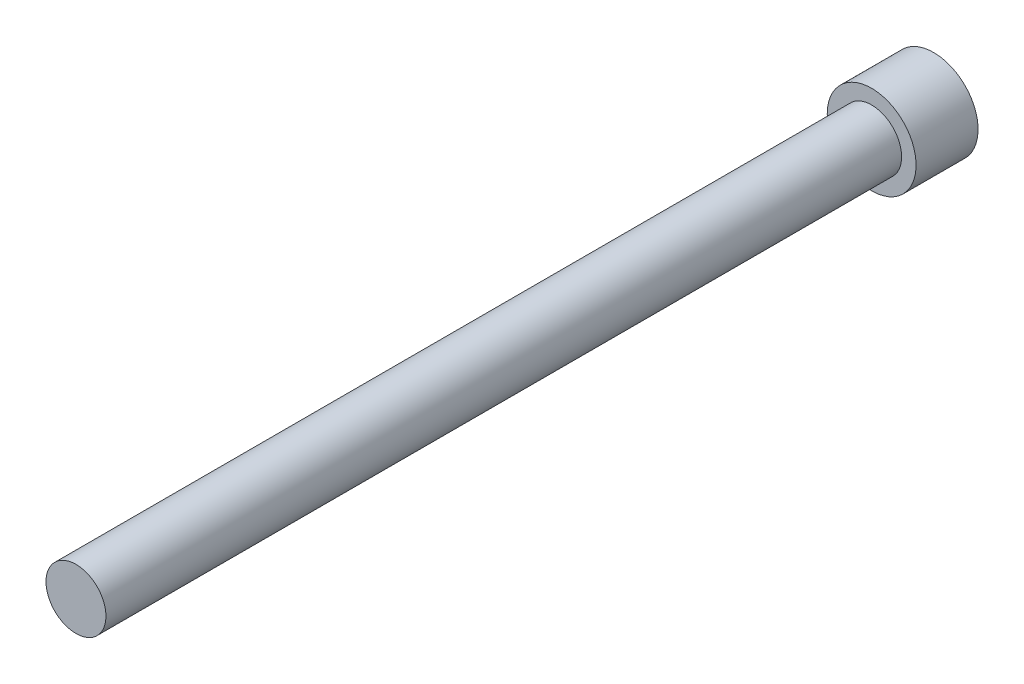
from build123d import *

# Parameters (mm, degrees)
SKETCH1_R           = 1.45
BOSS_EXTRUDE1_DEPTH = 41.5
SKETCH2_R           = 2.15
BOSS_EXTRUDE2_DEPTH = 3


with BuildPart() as part:
    # Sketch1 → Boss-Extrude1 (new body)
    with BuildSketch(Plane.XY):
        Circle(SKETCH1_R)
    extrude(amount=BOSS_EXTRUDE1_DEPTH)

    # Sketch2 → Boss-Extrude2 (add)
    with BuildSketch(Plane(origin=(0, 0, 0), x_dir=(-1, 0, 0), z_dir=(0, 0, -1))):
        Circle(SKETCH2_R)
    extrude(amount=-BOSS_EXTRUDE2_DEPTH)


solid = part.part
